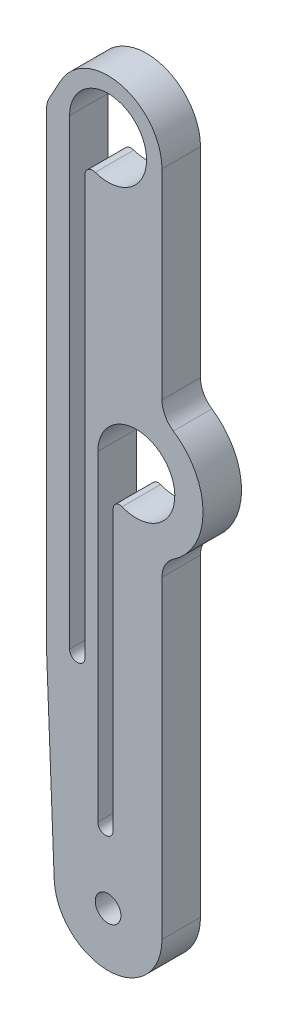
from build123d import *

# Parameters (mm, degrees)
SKETCH_1_R      = 1
EXTRUDE_1_DEPTH = 3


with BuildPart() as part:
    # 草图1 → 凸台-拉伸1 (new body)
    with BuildSketch(Plane.XY):
        with BuildLine():
            Line((-4.801725368, 51.134970407), (-4.801725368, 14.84551668))
            Line((-4.801725368, 14.84551668), (-4.196767432, -0.56475169))
            ThreePointArc((-4.196767432, -0.56475169), (0.0823917, -4.59919178), (4.2, -0.4))
            Line((4.2, -0.4), (4.2, 3))
            Line((4.2, 3), (4.2, 24.046707274))
            ThreePointArc((4.2, 24.046707274), (4.436165793, 24.989516316), (5.088888889, 25.709666113))
            ThreePointArc((5.088888889, 25.709666113), (7.4, 30.033359093), (5.088888889, 34.357052074))
            ThreePointArc((5.088888889, 34.357052074), (4.436165793, 35.077201871), (4.2, 36.020010912))
            Line((4.2, 36.020010912), (4.2, 47.4))
            Line((4.2, 47.4), (4.2, 51.6))
            ThreePointArc((4.2, 51.6), (1.019230191, 55.674453315), (-3.705318961, 53.577526587))
            Line((-3.705318961, 53.577526587), (-4.574814921, 52.00679382))
            ThreePointArc((-4.574814921, 52.00679382), (-4.743693388, 51.585307183), (-4.801725368, 51.134970407))
        make_face()
        with Locations((0, -0.4)):
            Circle(SKETCH_1_R, mode=Mode.SUBTRACT)
        with BuildLine():
            Line((-1.8, 15.6), (-1.8, 48.20588745))
            ThreePointArc((-1.8, 48.20588745), (-1.546410162, 48.695785399), (-1, 48.771572875))
            ThreePointArc((-1, 48.771572875), (2.449489743, 53.332050808), (-3, 51.6))
            Line((-3, 51.6), (-3, 15.6))
            ThreePointArc((-3, 15.6), (-2.4, 15), (-1.8, 15.6))
        make_face(mode=Mode.SUBTRACT)
        with BuildLine():
            Line((-0.8, 30.033359093), (-0.8, 5.033359093))
            ThreePointArc((-0.8, 5.033359093), (-0.2, 4.433359093), (0.4, 5.033359093))
            Line((0.4, 5.033359093), (0.4, 26.783743731))
            ThreePointArc((0.4, 26.783743731), (0.619694045, 27.197783067), (1.085714286, 27.247974497))
            ThreePointArc((1.085714286, 27.247974497), (4.684236014, 31.715194825), (-0.8, 30.033359093))
        make_face(mode=Mode.SUBTRACT)
    extrude(amount=EXTRUDE_1_DEPTH)


solid = part.part
